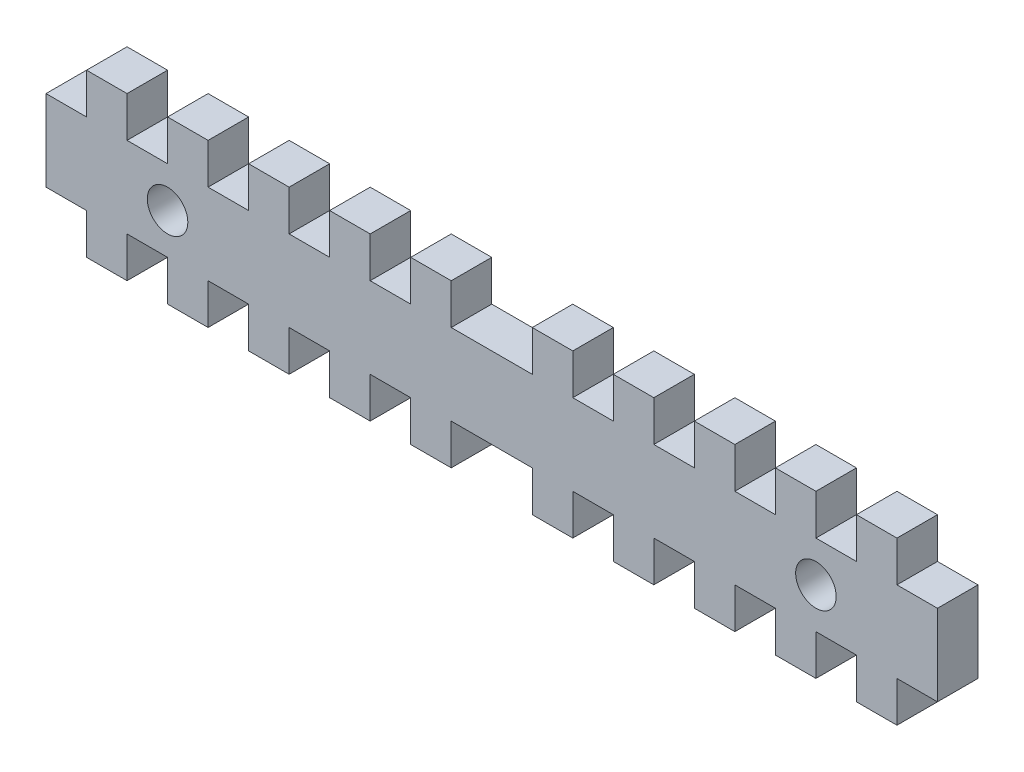
from build123d import *

# Parameters (mm, degrees)
SKETCH1_R           = 3.175
BOSS_EXTRUDE1_DEPTH = 6.35


with BuildPart() as part:
    # Sketch1 → Boss-Extrude1 (new body)
    with BuildSketch(Plane.XY):
        Polygon((-57.15, 12.7), (-63.5, 12.7), (-63.5, 6.35), (-69.85, 6.35), (-69.85, -6.35), (-63.5, -6.35), (-63.5, -12.7), (-57.15, -12.7), (-57.15, -6.35), (-50.8, -6.35), (-50.8, -12.7), (-44.45, -12.7), (-44.45, -6.35), (-38.1, -6.35), (-38.1, -12.7), (-31.75, -12.7), (-31.75, -6.35), (-25.4, -6.35), (-25.4, -12.7), (-19.05, -12.7), (-19.05, -6.35), (-12.7, -6.35), (-12.7, -12.7), (-6.35, -12.7), (-6.35, -6.35), (0, -6.35), (6.35, -6.35), (6.35, -12.7), (12.7, -12.7), (12.7, -6.35), (19.05, -6.35), (19.05, -12.7), (25.4, -12.7), (25.4, -6.35), (31.75, -6.35), (31.75, -12.7), (38.1, -12.7), (38.1, -6.35), (44.45, -6.35), (44.45, -12.7), (50.8, -12.7), (50.8, -6.35), (57.15, -6.35), (57.15, -12.7), (63.5, -12.7), (63.5, -6.35), (69.85, -6.35), (69.85, 6.35), (63.5, 6.35), (63.5, 12.7), (57.15, 12.7), (57.15, 6.35), (50.8, 6.35), (50.8, 12.7), (44.45, 12.7), (44.45, 6.35), (38.1, 6.35), (38.1, 12.7), (31.75, 12.7), (31.75, 6.35), (25.4, 6.35), (25.4, 12.7), (19.05, 12.7), (19.05, 6.35), (12.7, 6.35), (12.7, 12.7), (6.35, 12.7), (6.35, 6.35), (0, 6.35), (-6.35, 6.35), (-6.35, 12.7), (-12.7, 12.7), (-12.7, 6.35), (-19.05, 6.35), (-19.05, 12.7), (-25.4, 12.7), (-25.4, 6.35), (-31.75, 6.35), (-31.75, 12.7), (-38.1, 12.7), (-38.1, 6.35), (-44.45, 6.35), (-44.45, 12.7), (-50.8, 12.7), (-50.8, 6.35), (-57.15, 6.35), align=None)
        with Locations((-50.8, 0)):
            Circle(SKETCH1_R, mode=Mode.SUBTRACT)
        with Locations((50.8, 0)):
            Circle(SKETCH1_R, mode=Mode.SUBTRACT)
    extrude(amount=BOSS_EXTRUDE1_DEPTH)


solid = part.part
